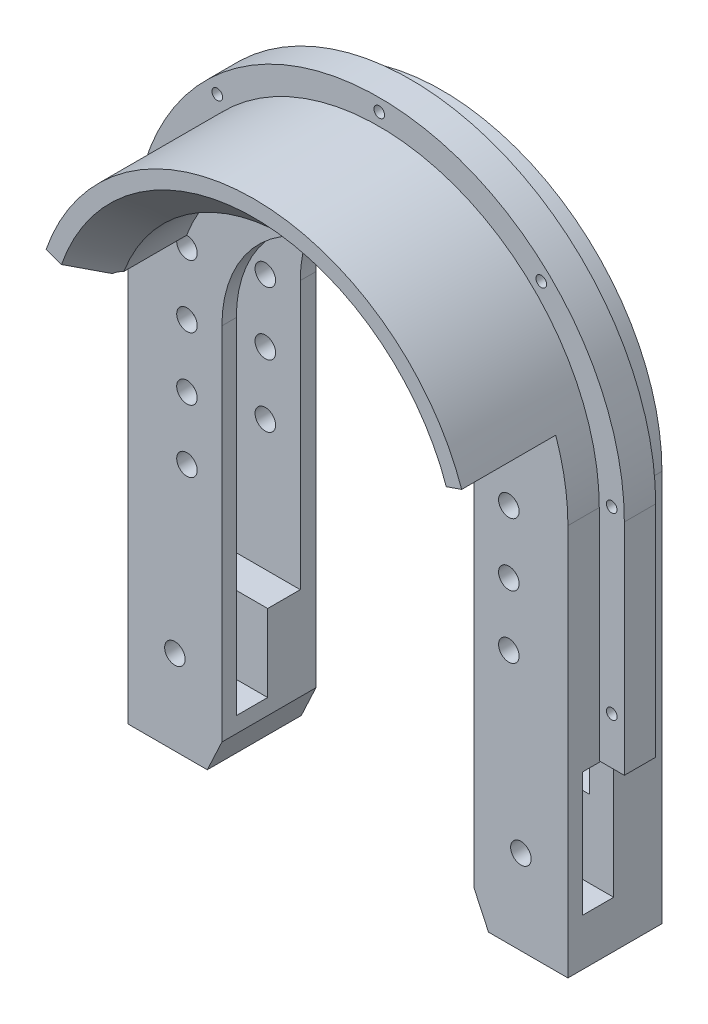
from build123d import *

# Parameters (mm, degrees)
BOSS_EXTRUDE1_DEPTH     = 30
CUT_EXTRUDE1_START      = 5
CUT_EXTRUDE1_DEPTH      = 20.4
SKETCH3_R               = 3.275
CUT_EXTRUDE2_DEPTH      = 139.032749737
LPATTERN1_COUNT         = 4
LPATTERN1_PITCH         = 20
CUT_EXTRUDE3_START      = -4.6
CUT_EXTRUDE3_DEPTH      = 10
SKETCH5_R               = 3.275
CUT_EXTRUDE4_DEPTH      = 17.6
BOSS_EXTRUDE2_DEPTH     = 30
MIRROR1_COPY_1_SKETCH_R = 3.275
MIRROR1_COPY_1_DEPTH    = 139.032749737
MIRROR1_COPY_2_SKETCH_R = 3.275
MIRROR1_COPY_2_DEPTH    = 139.032749737
MIRROR1_COPY_3_SKETCH_R = 3.275
MIRROR1_COPY_3_DEPTH    = 139.032749737
BOSS_EXTRUDE3_START     = 30
BOSS_EXTRUDE3_DEPTH     = 30
CUT_EXTRUDE5_REACH      = 148.469
BOSS_EXTRUDE4_DEPTH     = 30
BOSS_EXTRUDE5_DEPTH     = 5
CHAMFER1_SIZE           = 10
SKETCH11_R              = 1.7
CUT_EXTRUDE6_DEPTH      = 10


with BuildPart() as part:
    # Sketch1 → Boss-Extrude1 (new body)
    with BuildSketch(Plane.XY):
        with BuildLine():
            Line((70.2, 60), (-70.2, 60))
            Line((-70.2, 60), (-70.2, -115))
            Line((-70.2, -115), (-40.2, -115))
            Line((-40.2, -115), (-40.2, 0))
            ThreePointArc((-40.2, 0), (0, 40.2), (40.2, 0))
            Line((40.2, 0), (40.2, -115))
            Line((40.2, -115), (70.2, -115))
            Line((70.2, -115), (70.2, 60))
        make_face()
    extrude(amount=BOSS_EXTRUDE1_DEPTH)

    # Sketch2 → Cut-Extrude1 (cut)
    with BuildSketch(Plane.XY.offset(CUT_EXTRUDE1_START)):
        Polygon((25.2, 31.320919527), (25.2, -45), (40.2, -60), (40.2, -85.4), (62.5, -85.4), (62.5, 31.320919527), align=None)
    cut_extrude1 = extrude(amount=CUT_EXTRUDE1_DEPTH, mode=Mode.SUBTRACT)

    # Sketch3 → Cut-Extrude2 (cut, through all)
    with BuildSketch(Plane.XY.offset(30)):
        with Locations((51.35, 16.120919527)):
            Circle(SKETCH3_R)
    cut_extrude2 = extrude(amount=-CUT_EXTRUDE2_DEPTH, mode=Mode.SUBTRACT)

    # LPattern1: Cut-Extrude2 ×4
    with Locations(*[(0, -i * LPATTERN1_PITCH, 0) for i in range(1, LPATTERN1_COUNT)]):
        add(cut_extrude2, mode=Mode.SUBTRACT)

    # Sketch6 → Cut-Extrude3 (cut)
    with BuildSketch(Plane.XY.offset(30).offset(CUT_EXTRUDE3_START)):
        Polygon((40.2, -85.4), (55.2, -85.4), (55.2, -70.4), (70.2, -70.4), (70.2, -110), (40.2, -110), align=None)
    cut_extrude3 = extrude(amount=-CUT_EXTRUDE3_DEPTH, mode=Mode.SUBTRACT)

    # Sketch5 → Cut-Extrude4 (cut)
    with BuildSketch(Plane.XY.offset(30)):
        with Locations((55.2, -98)):
            Circle(SKETCH5_R)
    cut_extrude4 = extrude(amount=-CUT_EXTRUDE4_DEPTH, mode=Mode.SUBTRACT)

    # Sketch7 → Boss-Extrude2 (add)
    with BuildSketch(Plane.XY.offset(30)):
        Polygon((40.2, -115), (70.2, -115), (70.2, -125), (44.863076582, -125), align=None)
    boss_extrude2 = extrude(amount=-BOSS_EXTRUDE2_DEPTH)

    # Mirror1: Cut-Extrude1, Cut-Extrude2, Cut-Extrude3, Cut-Extrude4, Boss-Extrude2 across plane
    add(cut_extrude1.mirror(Plane(origin=(0, 0, 0), x_dir=(0, 0, 1), z_dir=(1, 0, 0))), mode=Mode.SUBTRACT)
    add(cut_extrude2.mirror(Plane(origin=(0, 0, 0), x_dir=(0, 0, 1), z_dir=(1, 0, 0))), mode=Mode.SUBTRACT)
    add(cut_extrude3.mirror(Plane(origin=(0, 0, 0), x_dir=(0, 0, 1), z_dir=(1, 0, 0))), mode=Mode.SUBTRACT)
    add(cut_extrude4.mirror(Plane(origin=(0, 0, 0), x_dir=(0, 0, 1), z_dir=(1, 0, 0))), mode=Mode.SUBTRACT)
    add(boss_extrude2.mirror(Plane(origin=(0, 0, 0), x_dir=(0, 0, 1), z_dir=(1, 0, 0))))

    # Mirror1 copy 1 sketch → Mirror1 copy 1 (cut, through all)
    with BuildSketch(Plane(origin=(0, -20, 30), x_dir=(-1, 0, 0), z_dir=(0, 0, 1))):
        with Locations((51.35, -16.120919527)):
            Circle(MIRROR1_COPY_1_SKETCH_R)
    extrude(amount=-MIRROR1_COPY_1_DEPTH, mode=Mode.SUBTRACT)

    # Mirror1 copy 2 sketch → Mirror1 copy 2 (cut, through all)
    with BuildSketch(Plane(origin=(0, -40, 30), x_dir=(-1, 0, 0), z_dir=(0, 0, 1))):
        with Locations((51.35, -16.120919527)):
            Circle(MIRROR1_COPY_2_SKETCH_R)
    extrude(amount=-MIRROR1_COPY_2_DEPTH, mode=Mode.SUBTRACT)

    # Mirror1 copy 3 sketch → Mirror1 copy 3 (cut, through all)
    with BuildSketch(Plane(origin=(0, -60, 30), x_dir=(-1, 0, 0), z_dir=(0, 0, 1))):
        with Locations((51.35, -16.120919527)):
            Circle(MIRROR1_COPY_3_SKETCH_R)
    extrude(amount=-MIRROR1_COPY_3_DEPTH, mode=Mode.SUBTRACT)

    # Sketch8 → Boss-Extrude3 (add)
    with BuildSketch(Plane.XY.offset(30).offset(BOSS_EXTRUDE3_START)):
        with BuildLine():
            ThreePointArc((51.467268944, 19.393819311), (52.549226062, 19.168456541), (53.494616948, 18.596044401))
            Line((53.494616948, 18.596044401), (66.307819698, 23.050228782))
            ThreePointArc((66.307819698, 23.050228782), (54.595945877, 44.128479395), (36.442283134, 60))
            Line((36.442283134, 60), (-36.442283134, 60))
            ThreePointArc((-36.442283134, 60), (-54.595945877, 44.128479395), (-66.307819698, 23.050228782))
            Line((-66.307819698, 23.050228782), (-53.494616948, 18.596044401))
            ThreePointArc((-53.494616948, 18.596044401), (-52.549226062, 19.168456541), (-51.467268944, 19.393819311))
            ThreePointArc((-51.467268944, 19.393819311), (0, 55), (51.467268944, 19.393819311))
        make_face()
        with BuildLine():
            Line((-36.442283134, 60), (36.442283134, 60))
            ThreePointArc((36.442283134, 60), (0, 70.2), (-36.442283134, 60))
        make_face()
    extrude(amount=-BOSS_EXTRUDE3_DEPTH)

    # Sketch8<3> → Cut-Extrude5 (cut, up to next)
    with BuildSketch(Plane.XY.offset(30), mode=Mode.PRIVATE) as cut_extrude5_sk1:
        with BuildLine():
            Line((-70.2, 24.403246372), (-66.307819698, 23.050228782))
            ThreePointArc((-66.307819698, 23.050228782), (-54.595945877, 44.128479395), (-36.442283134, 60))
            Line((-36.442283134, 60), (-70.2, 60))
            Line((-70.2, 60), (-70.2, 24.403246372))
        make_face()
    cut_extrude5_tool1 = extrude(cut_extrude5_sk1.sketch, amount=-CUT_EXTRUDE5_REACH, mode=Mode.PRIVATE) & part.part
    # Sketch8<3> → Cut-Extrude5 (cut, up to next)
    with BuildSketch(Plane.XY.offset(30), mode=Mode.PRIVATE) as cut_extrude5_sk2:
        with BuildLine():
            ThreePointArc((36.442283134, 60), (54.595945877, 44.128479395), (66.307819698, 23.050228782))
            Line((66.307819698, 23.050228782), (70.2, 24.403246372))
            Line((70.2, 24.403246372), (70.2, 60))
            Line((70.2, 60), (36.442283134, 60))
        make_face()
    cut_extrude5_tool2 = extrude(cut_extrude5_sk2.sketch, amount=-CUT_EXTRUDE5_REACH, mode=Mode.PRIVATE) & part.part
    # Sketch8<3> → Cut-Extrude5 (cut, up to next)
    with BuildSketch(Plane.XY.offset(30), mode=Mode.PRIVATE) as cut_extrude5_sk3:
        with BuildLine():
            ThreePointArc((-70.2, -2.11e-07), (-69.220116107, 11.688264463), (-66.307819698, 23.050228782))
            Line((-66.307819698, 23.050228782), (-70.2, 24.403246372))
            Line((-70.2, 24.403246372), (-70.2, -2.11e-07))
        make_face()
    cut_extrude5_tool3 = extrude(cut_extrude5_sk3.sketch, amount=-CUT_EXTRUDE5_REACH, mode=Mode.PRIVATE) & part.part
    # Sketch8<3> → Cut-Extrude5 (cut, up to next)
    with BuildSketch(Plane.XY.offset(30), mode=Mode.PRIVATE) as cut_extrude5_sk4:
        with BuildLine():
            Line((70.2, 24.403246372), (66.307819698, 23.050228782))
            ThreePointArc((66.307819698, 23.050228782), (67.781169893, 18.268908232), (68.910228278, 13.394791475))
            ThreePointArc((68.910228278, 13.394791475), (69.876813125, 6.728371827), (70.2, 0))
            Line((70.2, 0), (70.2, 24.403246372))
        make_face()
    cut_extrude5_tool4 = extrude(cut_extrude5_sk4.sketch, amount=-CUT_EXTRUDE5_REACH, mode=Mode.PRIVATE) & part.part
    add(cut_extrude5_tool1.solids().sort_by_distance((-60.211924, 47.421262, 30))[0], mode=Mode.SUBTRACT)
    add(cut_extrude5_tool2.solids().sort_by_distance((60.211924, 47.421262, 30))[0], mode=Mode.SUBTRACT)
    add(cut_extrude5_tool3.solids().sort_by_distance((-69.027031, 17.825577, 30))[0], mode=Mode.SUBTRACT)
    add(cut_extrude5_tool4.solids().sort_by_distance((69.027031, 17.825577, 30))[0], mode=Mode.SUBTRACT)

    # Sketch8<4> → Boss-Extrude4 (add)
    with BuildSketch(Plane.XY.offset(30)):
        with BuildLine():
            Line((-36.442283134, 60), (36.442283134, 60))
            ThreePointArc((36.442283134, 60), (0, 70.2), (-36.442283134, 60))
        make_face()
    extrude(amount=-BOSS_EXTRUDE4_DEPTH)

    # Sketch10 → Boss-Extrude5 (add, symmetric)
    with BuildSketch(Plane.XY.offset(15)):
        with BuildLine():
            Line((78.2, 0), (78.2, -70))
            Line((78.2, -70), (70.2, -70))
            Line((70.2, -70), (70.2, 0))
            ThreePointArc((70.2, 0), (69.220116089, 11.688264568), (66.307819698, 23.050228782))
            ThreePointArc((66.307819698, 23.050228782), (0, 70.2), (-66.307819698, 23.050228782))
            ThreePointArc((-66.307819698, 23.050228782), (-69.220116089, 11.688264568), (-70.2, 0))
            Line((-70.2, 0), (-70.2, -70))
            Line((-70.2, -70), (-78.2, -70))
            Line((-78.2, -70), (-78.2, 0))
            ThreePointArc((-78.2, 0), (-77.108448407, 13.02026053), (-73.864266387, 25.677035481))
            ThreePointArc((-73.864266387, 25.677035481), (0, 78.2), (73.864266387, 25.677035481))
            ThreePointArc((73.864266387, 25.677035481), (77.108448407, 13.02026053), (78.2, 0))
        make_face()
    extrude(amount=BOSS_EXTRUDE5_DEPTH, both=True)

    # Chamfer1
    chamfer1_edges = [part.edges().sort_by_distance(p)[0] for p in [
        (0, 55, 60),
    ]]
    chamfer(chamfer1_edges, length=CHAMFER1_SIZE)

    # Sketch11 → Cut-Extrude6 (cut)
    with BuildSketch(Plane.XY.offset(20)):
        with Locations((-74.2, -55)):
            Circle(SKETCH11_R)
        with Locations((-74.167849765, 2.184046985)):
            Circle(SKETCH11_R)
        with Locations((-51.689378569, 53.233900319)):
            Circle(SKETCH11_R)
        with Locations((0, 74.2)):
            Circle(SKETCH11_R)
        with Locations((51.689378569, 53.233900319)):
            Circle(SKETCH11_R)
        with Locations((74.167849765, 2.184046985)):
            Circle(SKETCH11_R)
        with Locations((74.2, -55)):
            Circle(SKETCH11_R)
    extrude(amount=-CUT_EXTRUDE6_DEPTH, mode=Mode.SUBTRACT)


solid = part.part
